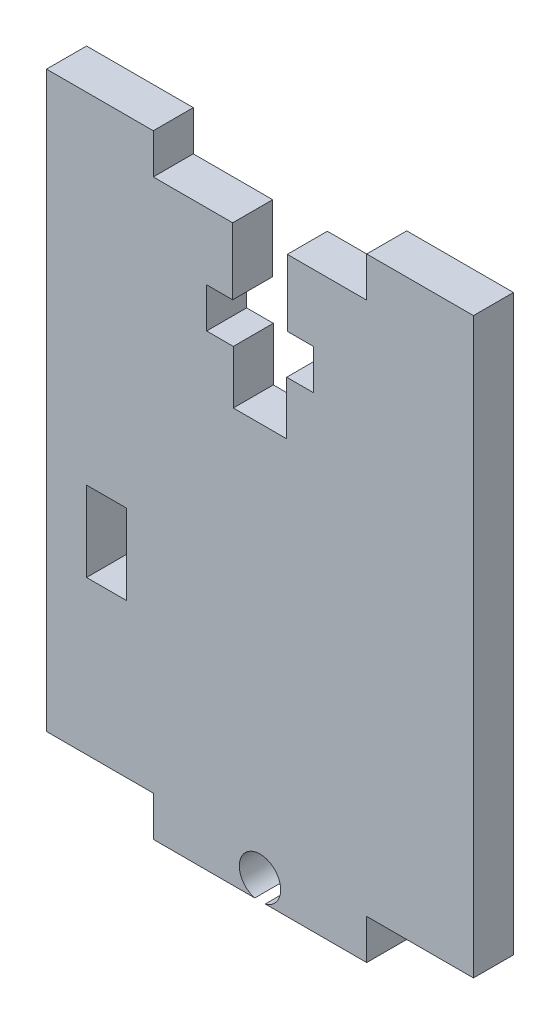
from build123d import *

# Parameters (mm, degrees)
SKETCH_2_W      = 3
SKETCH_2_H      = 6
EXTRUDE_1_DEPTH = 3


with BuildPart() as part:
    # 草图2 → 凸台-拉伸1 (new body)
    with BuildSketch(Plane.XY):
        with BuildLine():
            Line((2.047890023, 48.855305477), (8, 48.855305477))
            Line((8, 48.855305477), (8, 51.855305477))
            Line((8, 51.855305477), (16, 51.855305477))
            Line((16, 51.855305477), (16, 8.855305477))
            Line((16, 8.855305477), (8, 8.855305477))
            Line((8, 8.855305477), (8, 5.855305477))
            Line((8, 5.855305477), (0.390512484, 5.855305477))
            ThreePointArc((0.390512484, 5.855305477), (0, 8.905305477), (-0.390512484, 5.855305477))
            Line((-0.390512484, 5.855305477), (-8, 5.855305477))
            Line((-8, 5.855305477), (-8, 8.855305477))
            Line((-8, 8.855305477), (-16, 8.855305477))
            Line((-16, 8.855305477), (-16, 51.855305477))
            Line((-16, 51.855305477), (-8, 51.855305477))
            Line((-8, 51.855305477), (-8, 48.855305477))
            Line((-8, 48.855305477), (-2.047890023, 48.855305477))
            Line((-2.047890023, 48.855305477), (-2.047890023, 43.855305477))
            Line((-2.047890023, 43.855305477), (-4, 43.855305477))
            Line((-4, 43.855305477), (-4, 40.855305477))
            Line((-4, 40.855305477), (-2, 40.855305477))
            Line((-2, 40.855305477), (-2, 36.855305477))
            Line((-2, 36.855305477), (2, 36.855305477))
            Line((2, 36.855305477), (2, 40.855305477))
            Line((2, 40.855305477), (4, 40.855305477))
            Line((4, 40.855305477), (4, 43.855305477))
            Line((4, 43.855305477), (2.047890023, 43.855305477))
            Line((2.047890023, 43.855305477), (2.047890023, 48.855305477))
        make_face()
        with Locations((-11.5, 23.355305477)):
            Rectangle(SKETCH_2_W, SKETCH_2_H, mode=Mode.SUBTRACT)
    extrude(amount=EXTRUDE_1_DEPTH)


solid = part.part
